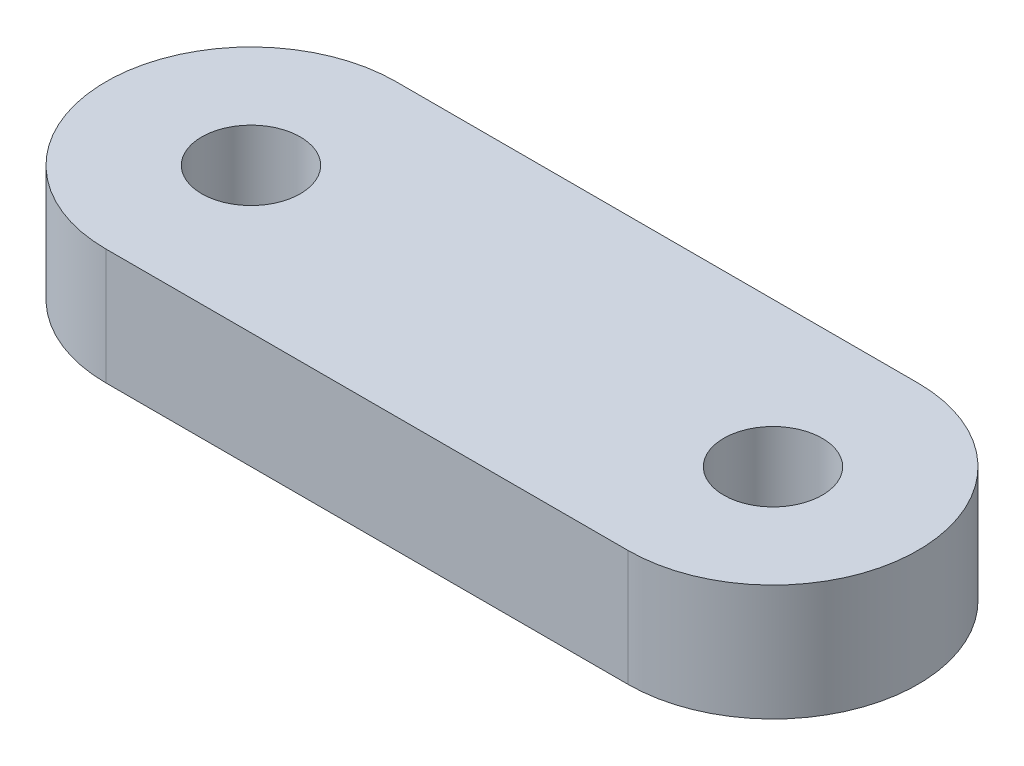
from build123d import *

# Parameters (mm, degrees)
SKETCH1_R           = 1.7
BOSS_EXTRUDE1_DEPTH = 4


with BuildPart() as part:
    # Sketch1 → Boss-Extrude1 (new body)
    with BuildSketch(Plane(origin=(0, 0, 0), x_dir=(1, 0, 0), z_dir=(0, 1, 0))):
        with BuildLine():
            Line((-9, 5), (9, 5))
            ThreePointArc((9, 5), (14, 0), (9, -5))
            Line((9, -5), (-9, -5))
            ThreePointArc((-9, -5), (-14, 0), (-9, 5))
        make_face()
        with Locations(Location((-9, 0, 0), (0, 0, 270))):
            Circle(SKETCH1_R, mode=Mode.SUBTRACT)
        with Locations(Location((9, 0, 0), (0, 0, 270))):
            Circle(SKETCH1_R, mode=Mode.SUBTRACT)
    extrude(amount=BOSS_EXTRUDE1_DEPTH)


solid = part.part
